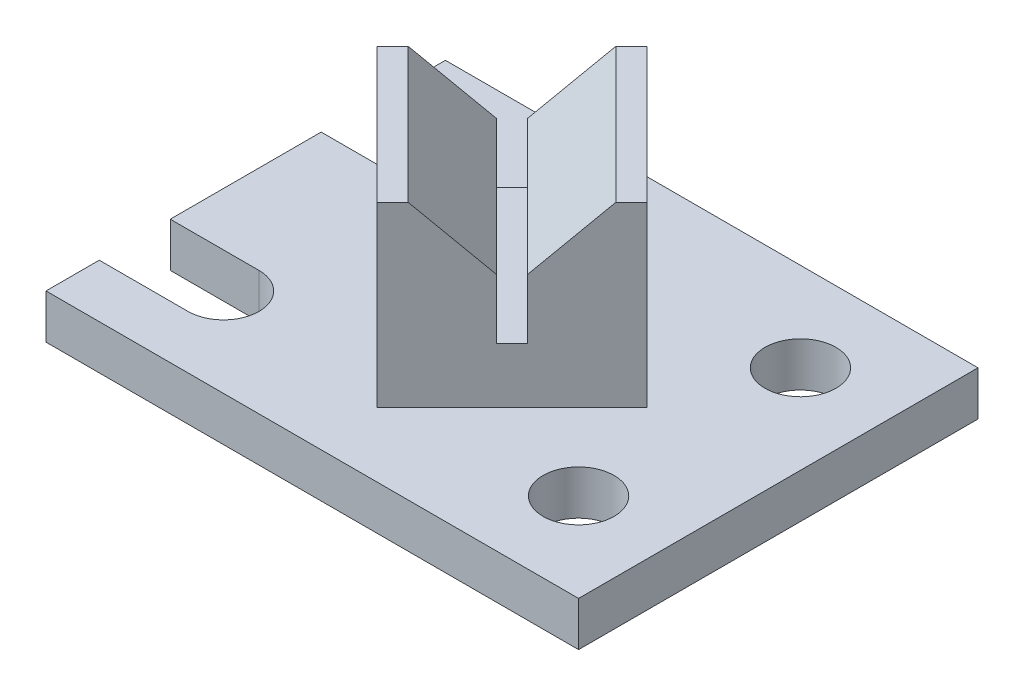
from build123d import *

# Parameters (mm, degrees)
CROQUIS1_W              = 152.4
CROQUIS1_H              = 114.3
SALIENTE_EXTRUIR1_DEPTH = 12.7
CROQUIS2_R              = 10.16
CORTAR_EXTRUIR1_DEPTH   = 97.092936785
SALIENTE_EXTRUIR2_DEPTH = 50.8
CORTAR_EXTRUIR2_DEPTH   = 138.873973454


with BuildPart() as part:
    # Croquis1 → Saliente-Extruir1 (new body)
    with BuildSketch(Plane(origin=(0, 0, 0), x_dir=(1, 0, 0), z_dir=(0, 1, 0))):
        Rectangle(CROQUIS1_W, CROQUIS1_H)
    extrude(amount=SALIENTE_EXTRUIR1_DEPTH)

    # Croquis2 → Cortar-Extruir1 (cut, through all)
    with BuildSketch(Plane(origin=(0, 12.7, 0), x_dir=(1, 0, 0), z_dir=(0, 1, 0))):
        with Locations(Location((50.8, -31.75, 0), (0, 0, 270))):
            Circle(CROQUIS2_R)
        with BuildLine():
            Line((-76.2, -21.59), (-50.8, -21.59))
            ThreePointArc((-50.8, -21.59), (-40.64, -31.75), (-50.8, -41.91))
            Line((-50.8, -41.91), (-76.2, -41.91))
            Line((-76.2, -41.91), (-76.2, -21.59))
        make_face()
    cortar_extruir1 = extrude(amount=-CORTAR_EXTRUIR1_DEPTH, mode=Mode.SUBTRACT)

    # Simetría1: Cortar-Extruir1 across plane
    add(cortar_extruir1.mirror(Plane.XY), mode=Mode.SUBTRACT)

    # Croquis3 → Saliente-Extruir2 (add)
    with BuildSketch(Plane(origin=(0, 12.7, 0), x_dir=(1, 0, 0), z_dir=(0, 1, 0))):
        Polygon((38.670529624, 0), (0, -38.670529624), (-38.670529624, 0), (0, 38.670529624), align=None)
    extrude(amount=SALIENTE_EXTRUIR2_DEPTH)

    # Croquis4 → Cortar-Extruir2 (cut, through all)
    with BuildSketch(Plane(origin=(19.335264812, 0, 19.335264812), x_dir=(0.7071067811865462, 0, -0.7071067811865488), z_dir=(0.7071067811865488, 0, 0.7071067811865462))):
        Polygon((-20.994193729, 63.5), (20.994193729, 63.5), (3.175, 45.680806271), (3.175, 28.575), (-3.175, 28.575), (-3.175, 45.680806271), align=None)
    extrude(amount=-CORTAR_EXTRUIR2_DEPTH, mode=Mode.SUBTRACT)


solid = part.part
